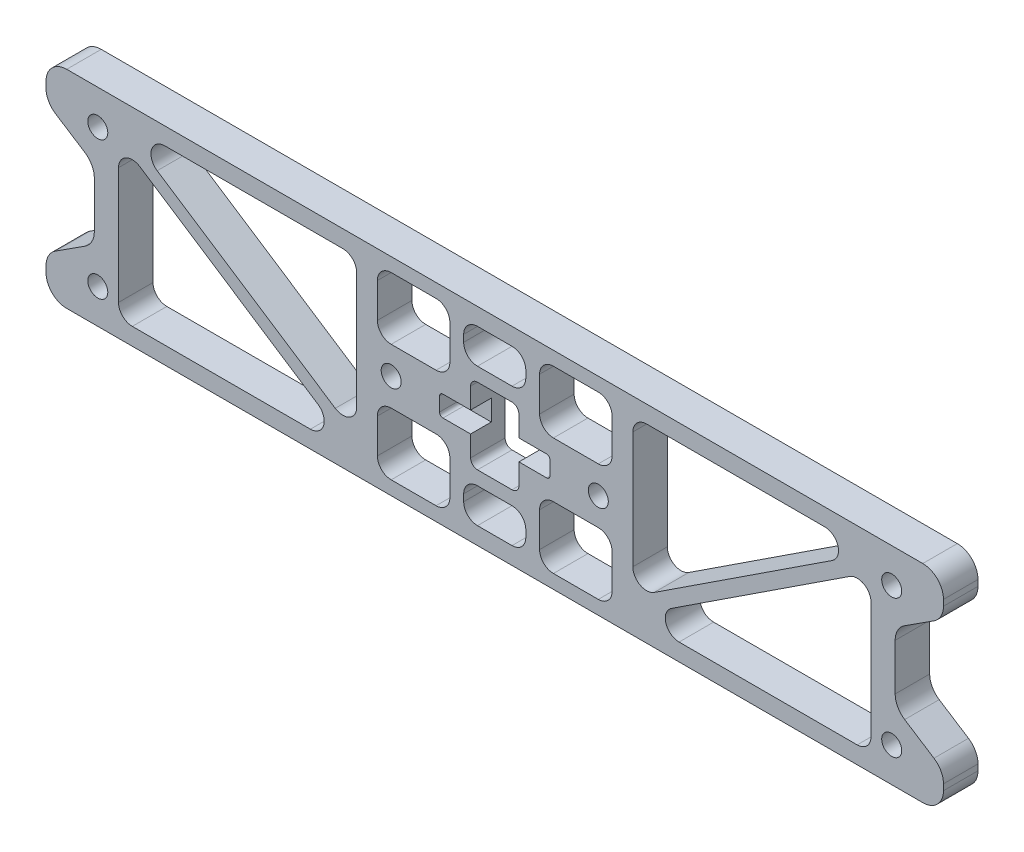
from build123d import *

# Parameters (mm, degrees)
SKETCH_1_W          = 130
SKETCH_1_H          = 30
SKETCH_1_R          = 1.45
EXTRUDE_1_DEPTH     = 5
SKETCH_3_W          = 16
SKETCH_3_H          = 3
CUT_EXTRUDE_1_DEPTH = 3
SKETCH_4_W          = 7
SKETCH_4_H          = 11
CUT_EXTRUDE_2_DEPTH = 67.895440801
SKETCH_6_W          = 34.5
SKETCH_6_H          = 25
SKETCH_6_W_2        = 10.5
SKETCH_6_H_2        = 9
SKETCH_6_W_3        = 9
SKETCH_6_H_3        = 5
CUT_EXTRUDE_3_DEPTH = 67.895440801
EXTRUDE_2_DEPTH     = 5
FILLET_1_R          = 2
FILLET_2_R          = 3
FILLET_3_R          = 1
FILLET_4_R          = 0.5


with BuildPart() as part:
    # 草图1 → 凸台-拉伸1 (new body)
    with BuildSketch(Plane.XY):
        Rectangle(SKETCH_1_W, SKETCH_1_H)
        with Locations((-57.5, -10)):
            Circle(SKETCH_1_R, mode=Mode.SUBTRACT)
        with Locations((-57.5, 10)):
            Circle(SKETCH_1_R, mode=Mode.SUBTRACT)
        with Locations(Location((57.5, -10, 0), (0, 0, 180))):
            Circle(SKETCH_1_R, mode=Mode.SUBTRACT)
        with Locations(Location((57.5, 10, 0), (0, 0, 180))):
            Circle(SKETCH_1_R, mode=Mode.SUBTRACT)
        with Locations((-15, 0)):
            Circle(SKETCH_1_R, mode=Mode.SUBTRACT)
        with Locations((15, 0)):
            Circle(SKETCH_1_R, mode=Mode.SUBTRACT)
    extrude(amount=EXTRUDE_1_DEPTH)

    # 草图3 → 切除-拉伸1 (cut)
    with BuildSketch(Plane.XY.offset(5)):
        Rectangle(SKETCH_3_W, SKETCH_3_H)
    extrude(amount=-CUT_EXTRUDE_1_DEPTH, mode=Mode.SUBTRACT)

    # 草图4 → 切除-拉伸2 (cut, through all)
    with BuildSketch(Plane.XY.offset(5)):
        Rectangle(SKETCH_4_W, SKETCH_4_H)
    extrude(amount=-CUT_EXTRUDE_2_DEPTH, mode=Mode.SUBTRACT)

    # 草图6 → 切除-拉伸3 (cut, through all)
    with BuildSketch(Plane.XY.offset(5)):
        Polygon((-65, 9.5), (-58, 5), (-58, -5), (-65, -9.5), align=None)
        with Locations((-37.25, 0)):
            Rectangle(SKETCH_6_W, SKETCH_6_H)
        with Locations((-11.75, 8.5)):
            Rectangle(SKETCH_6_W_2, SKETCH_6_H_2)
        with Locations((-11.75, -8.5)):
            Rectangle(SKETCH_6_W_2, SKETCH_6_H_2)
        with Locations((11.75, -8.5)):
            Rectangle(SKETCH_6_W_2, SKETCH_6_H_2)
        with Locations((11.75, 8.5)):
            Rectangle(SKETCH_6_W_2, SKETCH_6_H_2)
        with Locations((37.25, 0)):
            Rectangle(SKETCH_6_W, SKETCH_6_H)
        Polygon((65, -9.5), (65, 9.5), (58, 5), (58, -5), align=None)
        with Locations((0, 10)):
            Rectangle(SKETCH_6_W_3, SKETCH_6_H_3)
        with Locations((0, -10)):
            Rectangle(SKETCH_6_W_3, SKETCH_6_H_3)
    extrude(amount=-CUT_EXTRUDE_3_DEPTH, mode=Mode.SUBTRACT)

    # 草图7 → 凸台-拉伸2 (add)
    with BuildSketch(Plane.XY):
        Polygon((-54.5, 12.5), (-20, -10.108804199), (-20, -12.5), (-54.5, 10.108804199), align=None)
        Polygon((54.5, 12.5), (54.5, 10.108804199), (20, -12.5), (20, -10.108804199), align=None)
    extrude(amount=EXTRUDE_2_DEPTH)

    # 圆角1
    fillet_1_edges = [part.edges().sort_by_distance(p)[0] for p in [
        (-4.5, -12.5, 2.5),
        (-4.5, -7.5, 2.5),
        (4.5, -7.5, 2.5),
        (4.5, -12.5, 2.5),
        (6.5, -13, 2.5),
        (6.5, -4, 2.5),
        (17, -4, 2.5),
        (17, -13, 2.5),
        (-17, -4, 2.5),
        (-6.5, -4, 2.5),
        (-6.5, -13, 2.5),
        (-17, -13, 2.5),
        (-17, 13, 2.5),
        (-6.5, 13, 2.5),
        (-6.5, 4, 2.5),
        (-17, 4, 2.5),
        (-54.5, 12.5, 2.5),
        (-20, 12.5, 2.5),
        (-20, -12.5, 2.5),
        (-54.5, -12.5, 2.5),
        (-4.5, 7.5, 2.5),
        (-4.5, 12.5, 2.5),
        (4.5, 12.5, 2.5),
        (4.5, 7.5, 2.5),
        (20, -12.5, 2.5),
        (20, 12.5, 2.5),
        (54.5, 12.5, 2.5),
        (54.5, -12.5, 2.5),
        (6.5, 4, 2.5),
        (6.5, 13, 2.5),
        (17, 13, 2.5),
        (17, 4, 2.5),
        (-20, -10.108804199, 2.5),
        (-54.5, 10.108804199, 2.5),
        (54.5, 10.108804199, 2.5),
        (20, -10.108804199, 2.5),
    ]]
    fillet(fillet_1_edges, radius=FILLET_1_R)

    # 圆角2
    fillet_2_edges = [part.edges().sort_by_distance(p)[0] for p in [
        (-65, -9.5, 2.5),
        (-65, 9.5, 2.5),
        (-58, 5, 2.5),
        (-58, -5, 2.5),
        (65, -9.5, 2.5),
        (58, -5, 2.5),
        (58, 5, 2.5),
        (65, 9.5, 2.5),
        (65, -15, 2.5),
        (-65, -15, 2.5),
        (-65, 15, 2.5),
        (65, 15, 2.5),
    ]]
    fillet(fillet_2_edges, radius=FILLET_2_R)

    # 圆角3
    fillet_3_edges = [part.edges().sort_by_distance(p)[0] for p in [
        (3.5, 5.5, 2.5),
        (-3.5, -5.5, 2.5),
        (3.5, -5.5, 2.5),
        (-3.5, 5.5, 2.5),
    ]]
    fillet(fillet_3_edges, radius=FILLET_3_R)

    # 圆角4
    fillet_4_edges = [part.edges().sort_by_distance(p)[0] for p in [
        (8, 1.5, 3.5),
        (8, -1.5, 3.5),
        (-8, -1.5, 3.5),
        (-8, 1.5, 3.5),
    ]]
    fillet(fillet_4_edges, radius=FILLET_4_R)


solid = part.part
